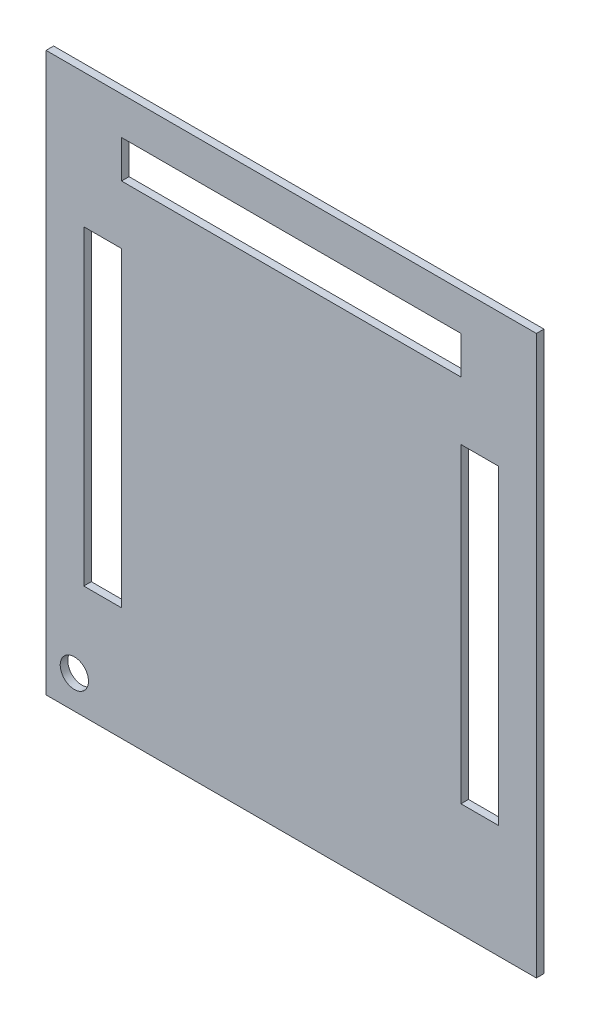
from build123d import *

# Parameters (mm, degrees)
CROQUIS1_W              = 260
CROQUIS1_H              = 296
SALIENTE_EXTRUIR1_DEPTH = 4
CROQUIS2_R              = 7.5
CROQUIS2_W              = 20
CROQUIS2_H              = 165
CROQUIS2_W_2            = 180
CROQUIS2_H_2            = 20
CORTAR_EXTRUIR1_DEPTH   = 4


with BuildPart() as part:
    # Croquis1 → Saliente-Extruir1 (new body)
    with BuildSketch(Plane.XY):
        with Locations((130, 148)):
            Rectangle(CROQUIS1_W, CROQUIS1_H)
    extrude(amount=SALIENTE_EXTRUIR1_DEPTH)

    # Croquis2 → Cortar-Extruir1 (cut)
    with BuildSketch(Plane.XY.offset(4)):
        with Locations((15, 17.5)):
            Circle(CROQUIS2_R)
        with Locations((30, 142.5)):
            Rectangle(CROQUIS2_W, CROQUIS2_H)
        with Locations((230, 142.5)):
            Rectangle(CROQUIS2_W, CROQUIS2_H)
        with Locations((130, 266)):
            Rectangle(CROQUIS2_W_2, CROQUIS2_H_2)
    extrude(amount=-CORTAR_EXTRUIR1_DEPTH, mode=Mode.SUBTRACT)


solid = part.part
